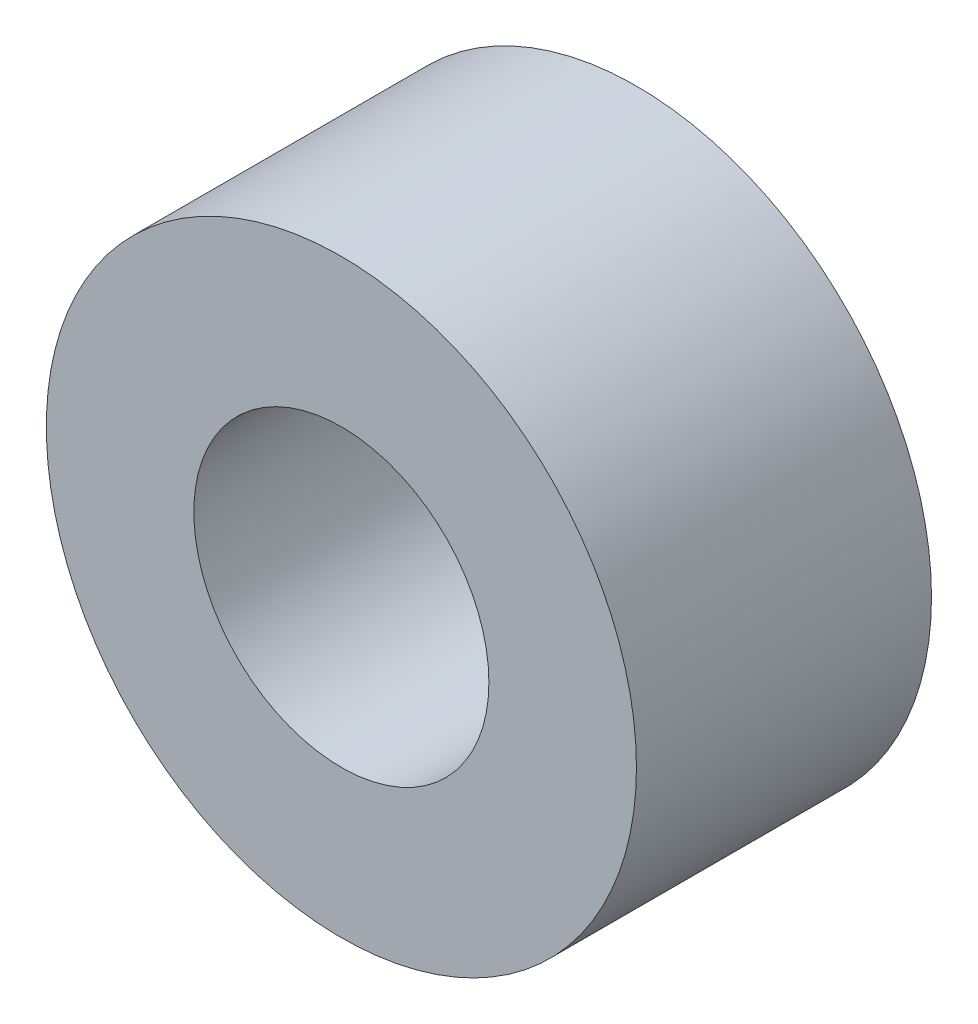
from build123d import *

# Parameters (mm, degrees)
SKETCH1_R           = 6.35
BOSS_EXTRUDE1_DEPTH = 6.35
SKETCH2_R           = 3.175
CUT_EXTRUDE1_DEPTH  = 6.35


with BuildPart() as part:
    # Sketch1 → Boss-Extrude1 (new body)
    with BuildSketch(Plane.XY):
        Circle(SKETCH1_R)
    extrude(amount=BOSS_EXTRUDE1_DEPTH)

    # Sketch2 → Cut-Extrude1 (cut)
    with BuildSketch(Plane.XY.offset(6.35)):
        Circle(SKETCH2_R)
    extrude(amount=-CUT_EXTRUDE1_DEPTH, mode=Mode.SUBTRACT)


solid = part.part
